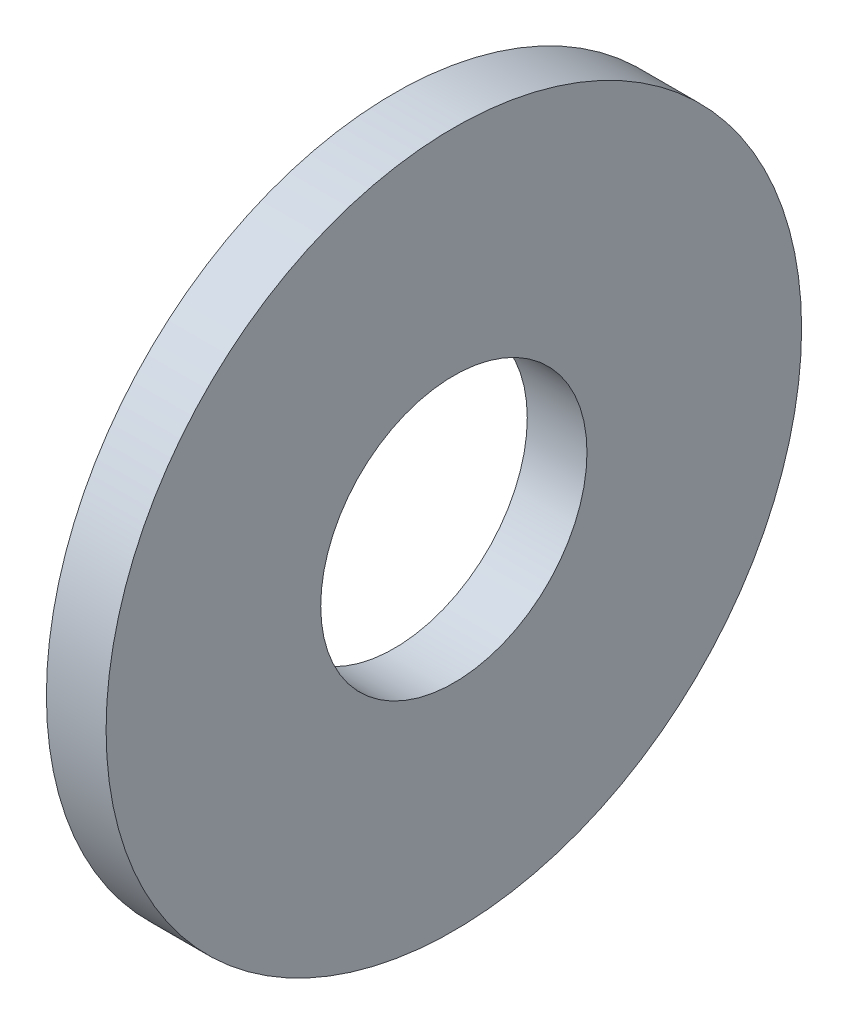
from build123d import *

# Parameters (mm, degrees)
SKETCH1_W = 1.6002
SKETCH1_H = 5.7531


with BuildPart() as part:
    # Sketch1 → Base-Revolve (revolve)
    with BuildSketch(Plane.XY, mode=Mode.PRIVATE) as base_revolve_sk:
        with Locations((-0.8001, 6.44525)):
            Rectangle(SKETCH1_W, SKETCH1_H)
    revolve(base_revolve_sk.sketch.rotate(Axis((-34.925, 0, 0), (1, 0, 0)), 90), axis=Axis((-34.925, 0, 0), (1, 0, 0)))


solid = part.part
